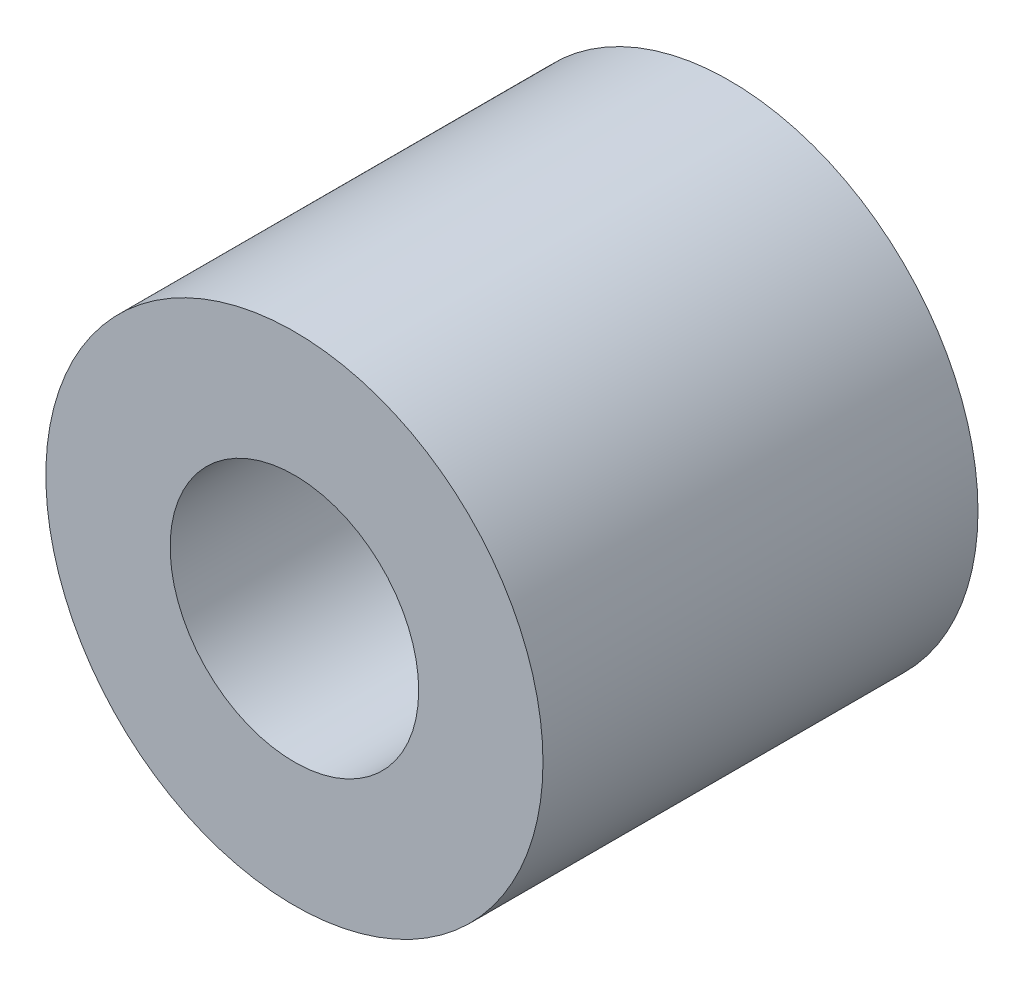
from build123d import *

# Parameters (mm, degrees)
SKETCH1_R           = 8
BOSS_EXTRUDE1_DEPTH = 2
SKETCH2_R           = 8
SKETCH2_R_2         = 4
BOSS_EXTRUDE2_DEPTH = 12


with BuildPart() as part:
    # Sketch1 → Boss-Extrude1 (new body)
    with BuildSketch(Plane.XY):
        Circle(SKETCH1_R)
    extrude(amount=BOSS_EXTRUDE1_DEPTH)

    # Sketch2 → Boss-Extrude2 (add)
    with BuildSketch(Plane.XY.offset(2)):
        Circle(SKETCH2_R)
        Circle(SKETCH2_R_2, mode=Mode.SUBTRACT)
    extrude(amount=BOSS_EXTRUDE2_DEPTH)


solid = part.part
